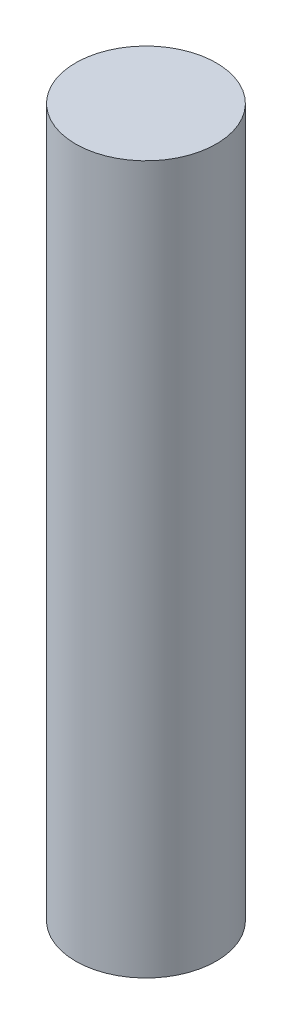
from build123d import *

# Parameters (mm, degrees)
SKETCH1_R           = 0.795
BOSS_EXTRUDE1_DEPTH = 8


with BuildPart() as part:
    # Sketch1 → Boss-Extrude1 (new body)
    with BuildSketch(Plane(origin=(0, 0, 0), x_dir=(1, 0, 0), z_dir=(0, 1, 0))):
        with Locations(Location((0, 0, 0), (0, 0, 270))):
            Circle(SKETCH1_R)
    extrude(amount=BOSS_EXTRUDE1_DEPTH)


solid = part.part
